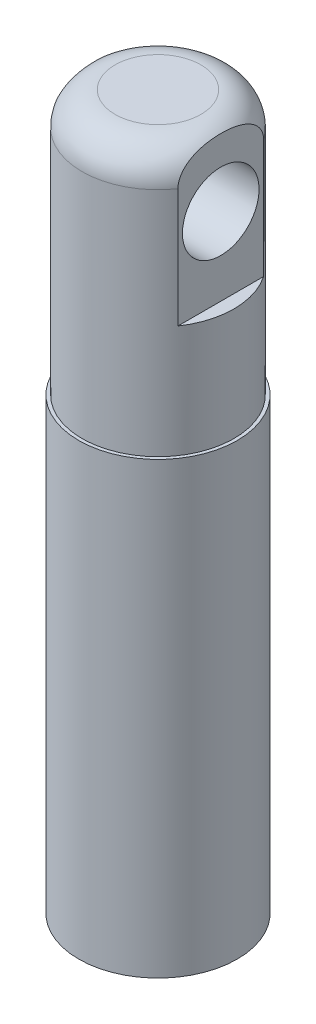
from build123d import *

# Parameters (mm, degrees)
SKETCH1_R           = 11.5
BOSS_EXTRUDE1_DEPTH = 108
FILLET1_R           = 5
SKETCH2_R           = 9.5
CUT_EXTRUDE1_DEPTH  = 80
CUT_EXTRUDE5_START  = -23
CUT_EXTRUDE5_DEPTH  = 23
SKETCH6_R           = 10.5
CUT_EXTRUDE7_DEPTH  = 1
SKETCH8_R           = 12
SKETCH8_R_2         = 11.5
BOSS_EXTRUDE2_DEPTH = 68
SKETCH9_R           = 5.8
CUT_EXTRUDE8_DEPTH  = 111.771160604


with BuildPart() as part:
    # Sketch1 → Boss-Extrude1 (new body)
    with BuildSketch(Plane(origin=(0, 0, 0), x_dir=(1, 0, 0), z_dir=(0, 1, 0))):
        with Locations(Location((0, 0, 0), (0, 0, 270))):
            Circle(SKETCH1_R)
    extrude(amount=BOSS_EXTRUDE1_DEPTH)

    # Fillet1
    fillet1_edges = [part.edges().sort_by_distance(p)[0] for p in [
        (0, 108, -11.5),
    ]]
    fillet(fillet1_edges, radius=FILLET1_R)

    # Sketch2 → Cut-Extrude1 (cut)
    with BuildSketch(Plane.XZ):
        with Locations(Location((0, 0, 0), (0, 0, 270))):
            Circle(SKETCH2_R)
    extrude(amount=-CUT_EXTRUDE1_DEPTH, mode=Mode.SUBTRACT)

    # Sketch3 → Cut-Extrude5 (cut)
    with BuildSketch(Plane(origin=(0, 108, 0), x_dir=(1, 0, 0), z_dir=(0, 1, 0)).offset(CUT_EXTRUDE5_START)):
        with BuildLine():
            Line((-9.5, 6.480740698), (-9.5, -6.480740698))
            ThreePointArc((-9.5, -6.480740698), (-11.5, 0), (-9.5, 6.480740698))
        make_face()
        with BuildLine():
            Line((9.5, 6.480740698), (9.5, -6.480740698))
            ThreePointArc((9.5, -6.480740698), (11.5, 0), (9.5, 6.480740698))
        make_face()
    extrude(amount=CUT_EXTRUDE5_DEPTH, mode=Mode.SUBTRACT)

    # Sketch6 → Cut-Extrude7 (cut)
    with BuildSketch(Plane.XZ.offset(-10)):
        with Locations(Location((0, 0, 0), (0, 0, 270))):
            Circle(SKETCH6_R)
    extrude(amount=CUT_EXTRUDE7_DEPTH, mode=Mode.SUBTRACT)

    # Sketch8 → Boss-Extrude2 (add)
    with BuildSketch(Plane.XZ):
        with Locations(Location((0, 0, 0), (0, 0, 270))):
            Circle(SKETCH8_R)
        with Locations(Location((0, 0, 0), (0, 0, 270))):
            Circle(SKETCH8_R_2, mode=Mode.SUBTRACT)
    extrude(amount=-BOSS_EXTRUDE2_DEPTH)

    # Sketch9 → Cut-Extrude8 (cut, through all)
    with BuildSketch(Plane.ZY.offset(9.5)):
        with Locations((0, 96.8)):
            Circle(SKETCH9_R)
    extrude(amount=-CUT_EXTRUDE8_DEPTH, mode=Mode.SUBTRACT)


solid = part.part
